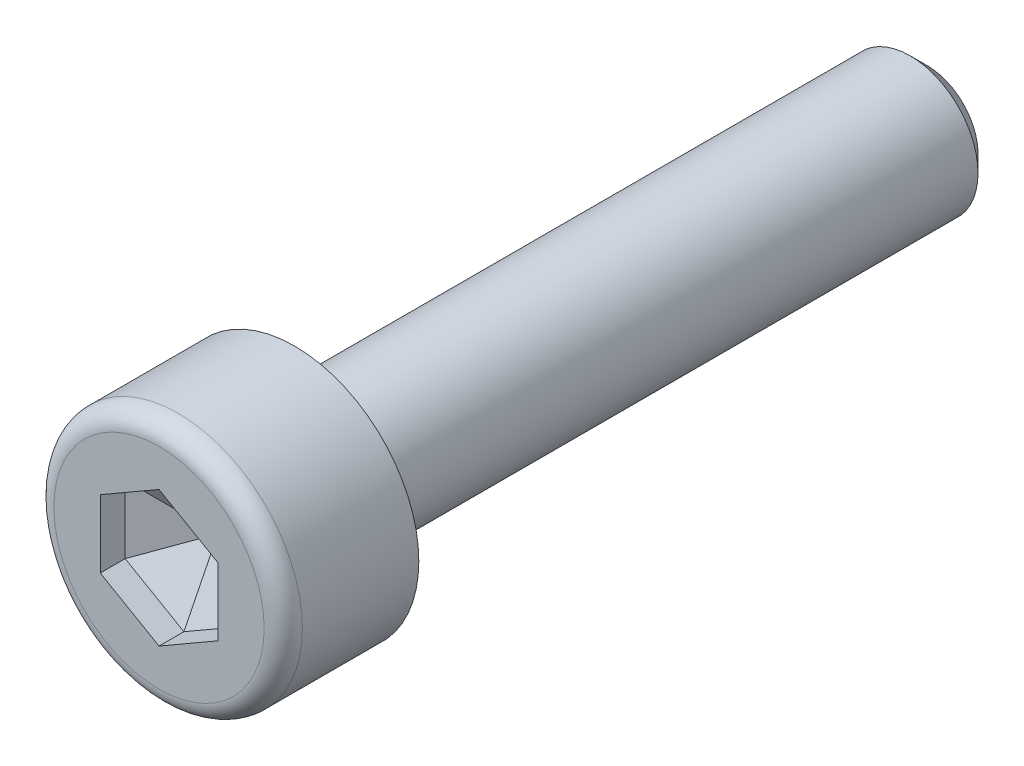
from build123d import *
from OCP.BRepFilletAPI import BRepFilletAPI_MakeChamfer

# Parameters (mm, degrees)
SKETCH_1_R          = 2.75
EXTRUDE_1_DEPTH     = 3
CUT_EXTRUDE_1_DEPTH = 1.3
SKETCH_3_R          = 1.5
EXTRUDE_2_DEPTH     = 14
CHAMFER_1_SIZE      = 0.375
FILLET_1_R          = 0.423076923
CHAMFER_2_SIZE      = 0.749279539
CHAMFER_2_SIZE2     = 1.29779023
FILLET_2_R          = 0.1


with BuildPart() as part:
    # 草图1 → 凸台-拉伸1 (new body)
    with BuildSketch(Plane.XY):
        Circle(SKETCH_1_R)
    extrude(amount=EXTRUDE_1_DEPTH)

    # 草图2 → 切除-拉伸1 (cut)
    with BuildSketch(Plane.XY.offset(3)):
        Polygon((1.3, 0.75055535), (0, 1.5011107), (-1.3, 0.75055535), (-1.3, -0.75055535), (0, -1.5011107), (1.3, -0.75055535), align=None)
    extrude(amount=-CUT_EXTRUDE_1_DEPTH, mode=Mode.SUBTRACT)

    # 草图3 → 凸台-拉伸2 (add)
    with BuildSketch(Plane(origin=(0, 0, 0), x_dir=(-1, 0, 0), z_dir=(0, 0, -1))):
        Circle(SKETCH_3_R)
    extrude(amount=EXTRUDE_2_DEPTH)

    # 倒角1
    chamfer_1_edges = [part.edges().sort_by_distance(p)[0] for p in [
        (1.5, 0, -14),
    ]]
    chamfer(chamfer_1_edges, length=CHAMFER_1_SIZE)

    # 圆角1
    fillet_1_edges = [part.edges().sort_by_distance(p)[0] for p in [
        (-2.75, 0, 3),
    ]]
    fillet(fillet_1_edges, radius=FILLET_1_R)

    # 倒角2: one chamfer whose edges measure the first distance from different faces: ONE call of the kernel's chamfer builder (chamfer() names one face for all edges)
    chamfer_2_edges_1 = [part.edges().sort_by_distance(p)[0] for p in [
        (-1.3, 0, 1.7),
    ]]
    chamfer_2_side_1 = [part.faces().sort_by_distance(p)[0] for p in [
        (-1.3, 0, 2.35),
    ]]
    chamfer_2_edges_2 = [part.edges().sort_by_distance(p)[0] for p in [
        (-0.65, 1.125833025, 1.7),
    ]]
    chamfer_2_side_2 = [part.faces().sort_by_distance(p)[0] for p in [
        (-0.65, 1.125833025, 2.35),
    ]]
    chamfer_2_edges_3 = [part.edges().sort_by_distance(p)[0] for p in [
        (0.65, 1.125833025, 1.7),
    ]]
    chamfer_2_side_3 = [part.faces().sort_by_distance(p)[0] for p in [
        (0.65, 1.125833025, 2.35),
    ]]
    chamfer_2_edges_4 = [part.edges().sort_by_distance(p)[0] for p in [
        (1.3, 0, 1.7),
    ]]
    chamfer_2_side_4 = [part.faces().sort_by_distance(p)[0] for p in [
        (1.3, 0, 2.35),
    ]]
    chamfer_2_edges_5 = [part.edges().sort_by_distance(p)[0] for p in [
        (-0.65, -1.125833025, 1.7),
    ]]
    chamfer_2_side_5 = [part.faces().sort_by_distance(p)[0] for p in [
        (-0.65, -1.125833025, 2.35),
    ]]
    chamfer_2_edges_6 = [part.edges().sort_by_distance(p)[0] for p in [
        (0.65, -1.125833025, 1.7),
    ]]
    chamfer_2_side_6 = [part.faces().sort_by_distance(p)[0] for p in [
        (0.65, -1.125833025, 2.35),
    ]]
    chamfer_2 = BRepFilletAPI_MakeChamfer(part.part.solid().wrapped)
    for e in chamfer_2_edges_1:
        chamfer_2.Add(CHAMFER_2_SIZE, CHAMFER_2_SIZE2, e.wrapped, chamfer_2_side_1[0].wrapped)  # the first distance lies on this face
    for e in chamfer_2_edges_2:
        chamfer_2.Add(CHAMFER_2_SIZE, CHAMFER_2_SIZE2, e.wrapped, chamfer_2_side_2[0].wrapped)  # the first distance lies on this face
    for e in chamfer_2_edges_3:
        chamfer_2.Add(CHAMFER_2_SIZE, CHAMFER_2_SIZE2, e.wrapped, chamfer_2_side_3[0].wrapped)  # the first distance lies on this face
    for e in chamfer_2_edges_4:
        chamfer_2.Add(CHAMFER_2_SIZE, CHAMFER_2_SIZE2, e.wrapped, chamfer_2_side_4[0].wrapped)  # the first distance lies on this face
    for e in chamfer_2_edges_5:
        chamfer_2.Add(CHAMFER_2_SIZE, CHAMFER_2_SIZE2, e.wrapped, chamfer_2_side_5[0].wrapped)  # the first distance lies on this face
    for e in chamfer_2_edges_6:
        chamfer_2.Add(CHAMFER_2_SIZE, CHAMFER_2_SIZE2, e.wrapped, chamfer_2_side_6[0].wrapped)  # the first distance lies on this face
    add(Compound.cast(chamfer_2.Shape()), mode=Mode.REPLACE)

    # 圆角2
    fillet_2_edges = [part.edges().sort_by_distance(p)[0] for p in [
        (1.5, 0, 0),
    ]]
    fillet(fillet_2_edges, radius=FILLET_2_R)


solid = part.part
